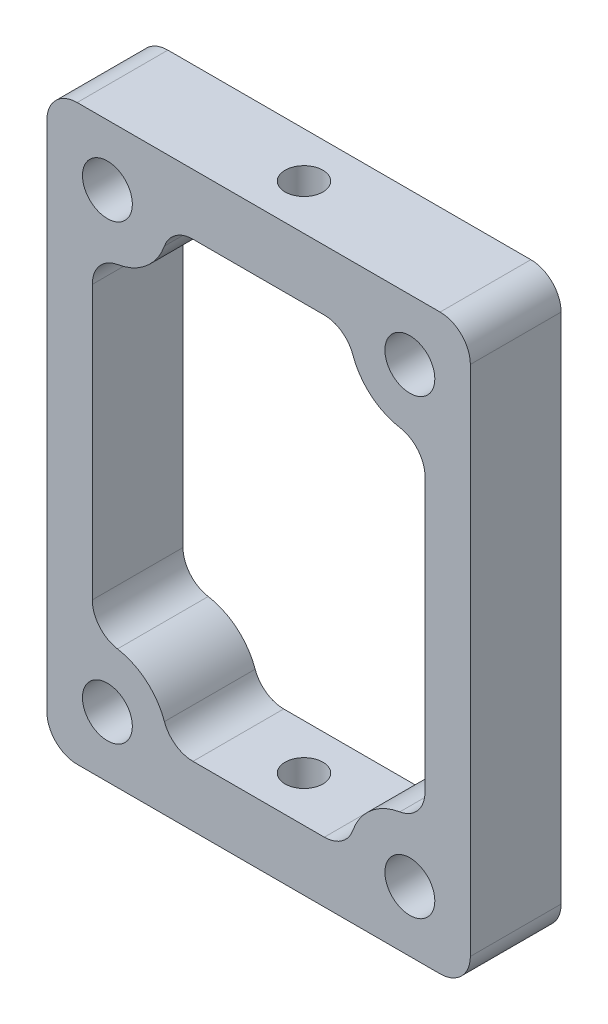
from build123d import *

# Parameters (mm, degrees)
SKETCH_1_W          = 28
SKETCH_1_H          = 37.9
EXTRUDE_1_DEPTH     = 3
HOLE_WIZARD_M4_1_D  = 3.3
CUT_EXTRUDE_1_DEPTH = 8
FILLET_1_R          = 2
CUT_EXTRUDE_2_DEPTH = 8
FILLET_3_R          = 2
HOLE_WIZARD_M3_1_D  = 2.5


with BuildPart() as part:
    # 草图1 → 凸台-拉伸1 (new, symmetric)
    with BuildSketch(Plane.XY):
        Rectangle(SKETCH_1_W, SKETCH_1_H)
    extrude(amount=EXTRUDE_1_DEPTH, both=True)

    # M4 螺纹孔1 (through all)
    with Locations(Plane.XY.offset(3)):
        with Locations((-10, 14.95), (10, 14.95), (10, -14.95), (-10, -14.95)):
            Hole(HOLE_WIZARD_M4_1_D / 2)

    # 草图5 → 切除-拉伸1 (cut)
    with BuildSketch(Plane.XY.offset(3)):
        with BuildLine():
            ThreePointArc((-10, -10.95), (-7.171572875, -12.121572875), (-6, -14.95))
            Line((-6, -14.95), (6, -14.95))
            ThreePointArc((6, -14.95), (7.171572875, -12.121572875), (10, -10.95))
            Line((10, -10.95), (10, 10.95))
            ThreePointArc((10, 10.95), (7.171572875, 12.121572875), (6, 14.95))
            Line((6, 14.95), (-6, 14.95))
            ThreePointArc((-6, 14.95), (-7.171572875, 12.121572875), (-10, 10.95))
            Line((-10, 10.95), (-10, -10.95))
        make_face()
    extrude(amount=-CUT_EXTRUDE_1_DEPTH, mode=Mode.SUBTRACT)

    # 圆角1
    fillet_1_edges = [part.edges().sort_by_distance(p)[0] for p in [
        (14, -18.95, 0),
        (-14, -18.95, 0),
        (-14, 18.95, 0),
        (14, 18.95, 0),
    ]]
    fillet(fillet_1_edges, radius=FILLET_1_R)

    # 草图6 → 切除-拉伸2 (cut)
    with BuildSketch(Plane.XY.offset(3)):
        with BuildLine():
            Line((-11, 11.077016654), (-11, -11.077016654))
            ThreePointArc((-11, -11.077016654), (-10.50401717, -10.981881215), (-10, -10.95))
            Line((-10, -10.95), (-10, 10.95))
            ThreePointArc((-10, 10.95), (-10.50401717, 10.981881215), (-11, 11.077016654))
        make_face()
        with BuildLine():
            Line((11, 11.077016654), (11, -11.077016654))
            ThreePointArc((11, -11.077016654), (10.50401717, -10.981881215), (10, -10.95))
            Line((10, -10.95), (10, 10.95))
            ThreePointArc((10, 10.95), (10.50401717, 10.981881215), (11, 11.077016654))
        make_face()
    extrude(amount=-CUT_EXTRUDE_2_DEPTH, mode=Mode.SUBTRACT)

    # 圆角3
    fillet_3_edges = [part.edges().sort_by_distance(p)[0] for p in [
        (-11, 11.077016654, 0),
        (-11, -11.077016654, 0),
        (11, 11.077016654, 0),
        (11, -11.077016654, 0),
        (6, -14.95, 0),
        (-6, -14.95, 0),
        (-6, 14.95, 0),
        (6, 14.95, 0),
    ]]
    fillet(fillet_3_edges, radius=FILLET_3_R)

    # M3 螺纹孔1 (through all)
    with Locations(Plane(origin=(0, 18.95, 0), x_dir=(1, 0, 0), z_dir=(0, 1, 0))):
        with Locations((0, 0)):
            Hole(HOLE_WIZARD_M3_1_D / 2)


solid = part.part
